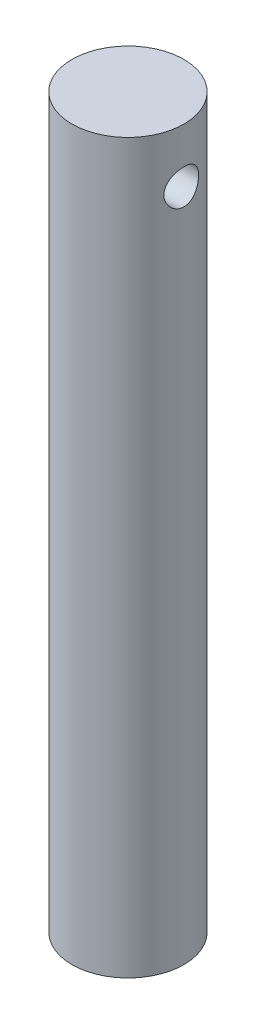
from build123d import *

# Parameters (mm, degrees)
SKETCH_1_R              = 10
EXTRUDE_1_DEPTH         = 130
HOLE_WIZARD_6_2_6_2_1_D = 6.2


with BuildPart() as part:
    # 草图1 → 凸台-拉伸1 (new body)
    with BuildSketch(Plane(origin=(0, 0, 0), x_dir=(1, 0, 0), z_dir=(0, 1, 0))):
        with Locations(Location((0, 0, 0), (0, 0, 270))):
            Circle(SKETCH_1_R)
    extrude(amount=EXTRUDE_1_DEPTH)

    # Ø6.2 (6.2) 直径孔1 (through all)
    with Locations(Plane(origin=(10, 120.3, 0), x_dir=(0, 0, 1), z_dir=(1, 0, 0))):
        with Locations((0, 0)):
            Hole(HOLE_WIZARD_6_2_6_2_1_D / 2)


solid = part.part
